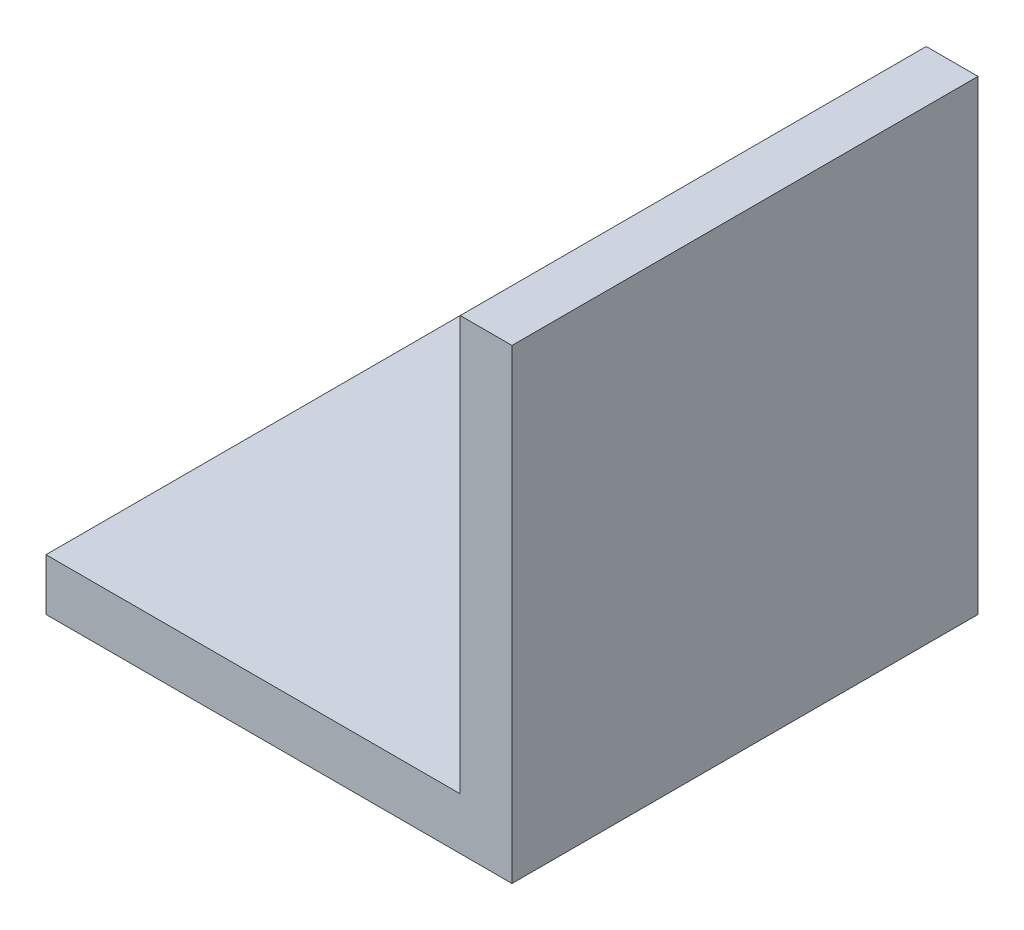
from build123d import *

# Parameters (mm, degrees)
SKETCH1_W           = 76.2
SKETCH1_H           = 76.2
BOSS_EXTRUDE1_DEPTH = 8.46666582
SKETCH2_W           = 76.2
SKETCH2_H           = 76.2
BOSS_EXTRUDE2_DEPTH = 8.466666667


with BuildPart() as part:
    # Sketch1 → Boss-Extrude1 (new body)
    with BuildSketch(Plane(origin=(0, 0, 0), x_dir=(1, 0, 0), z_dir=(0, 1, 0))):
        with Locations((-11.329876444, 0.512096774)):
            Rectangle(SKETCH1_W, SKETCH1_H)
    extrude(amount=BOSS_EXTRUDE1_DEPTH)

    # Sketch2 → Boss-Extrude2 (add)
    with BuildSketch(Plane(origin=(26.770123556, 0, 0), x_dir=(0, 0, -1), z_dir=(1, 0, 0))):
        with Locations((0.512096774, 38.1)):
            Rectangle(SKETCH2_W, SKETCH2_H)
    extrude(amount=-BOSS_EXTRUDE2_DEPTH)


solid = part.part
